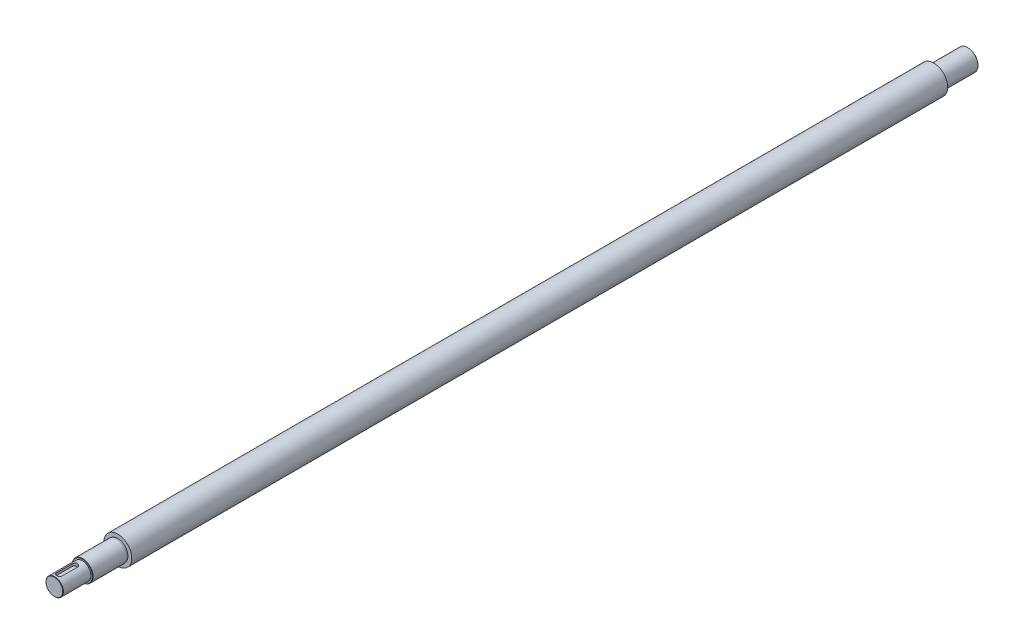
from build123d import *

# Parameters (mm, degrees)
SKETCH_1_R          = 12.5
EXTRUDE_1_DEPTH     = 40
CHAMFER_1_SIZE      = 0.5
CUT_EXTRUDE_1_DEPTH = 4
SKETCH_4_R          = 15
EXTRUDE_2_DEPTH     = 49
CHAMFER_2_SIZE      = 0.5
SKETCH_7_R          = 14.5
EXTRUDE_3_DEPTH     = 2
SKETCH_8_R          = 20
EXTRUDE_4_DEPTH     = 1170
SKETCH_9_R          = 14.5
EXTRUDE_5_DEPTH     = 2
SKETCH_10_R         = 15
EXTRUDE_6_DEPTH     = 47
CHAMFER_3_SIZE      = 0.5


with BuildPart() as part:
    # 草图1 → 凸台-拉伸1 (new body)
    with BuildSketch(Plane.XY):
        Circle(SKETCH_1_R)
    extrude(amount=EXTRUDE_1_DEPTH)

    # 倒角1
    chamfer_1_edges = [part.edges().sort_by_distance(p)[0] for p in [
        (-12.5, 0, 40),
    ]]
    chamfer(chamfer_1_edges, length=CHAMFER_1_SIZE)

    # 草图3 → 切除-拉伸1 (cut)
    with BuildSketch(Plane(origin=(0, 12.5, 0), x_dir=(1, 0, 0), z_dir=(0, 1, 0))):
        with BuildLine():
            Line((4, -11), (4, -33))
            ThreePointArc((4, -33), (0, -37), (-4, -33))
            Line((-4, -33), (-4, -11))
            ThreePointArc((-4, -11), (0, -7), (4, -11))
        make_face()
    extrude(amount=-CUT_EXTRUDE_1_DEPTH, mode=Mode.SUBTRACT)

    # 草图4 → 凸台-拉伸2 (add)
    with BuildSketch(Plane(origin=(0, 0, 0), x_dir=(-1, 0, 0), z_dir=(0, 0, -1))):
        Circle(SKETCH_4_R)
    extrude(amount=EXTRUDE_2_DEPTH)

    # 倒角2
    chamfer_2_edges = [part.edges().sort_by_distance(p)[0] for p in [
        (15, 0, 0),
    ]]
    chamfer(chamfer_2_edges, length=CHAMFER_2_SIZE)

    # 草图7 → 凸台-拉伸3 (add)
    with BuildSketch(Plane(origin=(0, 0, -49), x_dir=(-1, 0, 0), z_dir=(0, 0, -1))):
        Circle(SKETCH_7_R)
    extrude(amount=EXTRUDE_3_DEPTH)

    # 草图8 → 凸台-拉伸4 (add)
    with BuildSketch(Plane(origin=(0, 0, -51), x_dir=(-1, 0, 0), z_dir=(0, 0, -1))):
        Circle(SKETCH_8_R)
    extrude(amount=EXTRUDE_4_DEPTH)

    # 草图9 → 凸台-拉伸5 (add)
    with BuildSketch(Plane(origin=(0, 0, -1221), x_dir=(-1, 0, 0), z_dir=(0, 0, -1))):
        Circle(SKETCH_9_R)
    extrude(amount=EXTRUDE_5_DEPTH)

    # 草图10 → 凸台-拉伸6 (add)
    with BuildSketch(Plane(origin=(0, 0, -1223), x_dir=(-1, 0, 0), z_dir=(0, 0, -1))):
        Circle(SKETCH_10_R)
    extrude(amount=EXTRUDE_6_DEPTH)

    # 倒角3
    chamfer_3_edges = [part.edges().sort_by_distance(p)[0] for p in [
        (15, 0, -1270),
    ]]
    chamfer(chamfer_3_edges, length=CHAMFER_3_SIZE)


solid = part.part
